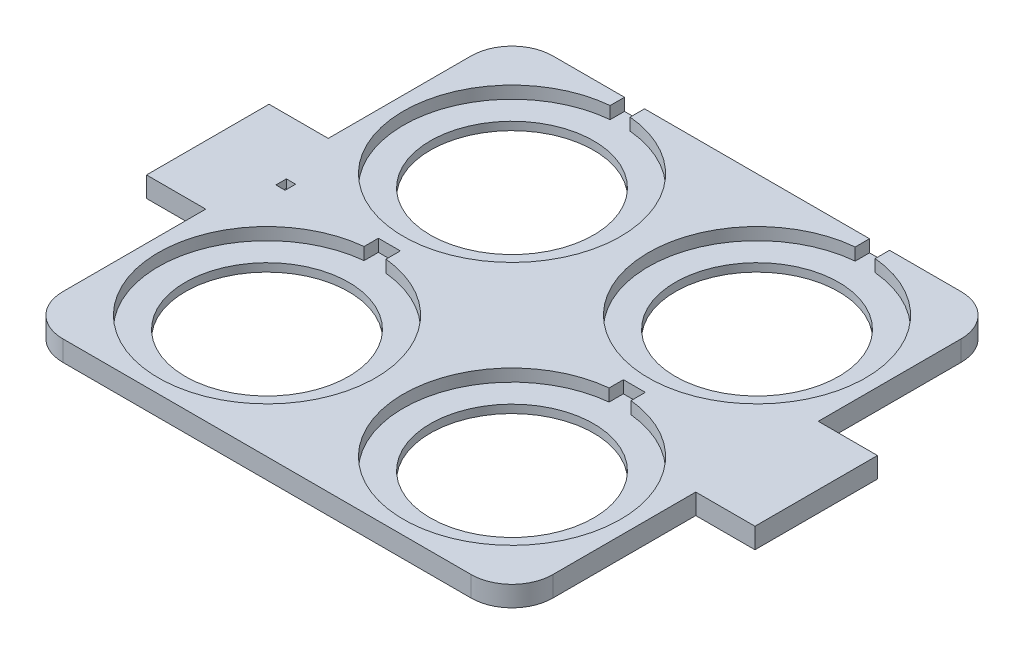
from build123d import *

# Parameters (mm, degrees)
SKETCH1_W           = 120
SKETCH1_H           = 120
BOSS_EXTRUDE1_DEPTH = 5
SKETCH2_R           = 20
CUT_EXTRUDE4_DEPTH  = 5
SKETCH3_R           = 26.6
SKETCH3_R_2         = 20
CUT_EXTRUDE5_DEPTH  = 3
SKETCH4_W           = 60
SKETCH4_H           = 5
BOSS_EXTRUDE2_DEPTH = 14.5
SKETCH5_W           = 60
SKETCH5_H           = 5
BOSS_EXTRUDE3_DEPTH = 14.5
FILLET3_R           = 10
FILLET4_R           = 10
FILLET5_R           = 10
FILLET6_R           = 10
SKETCH10_W          = 2.261137553
SKETCH10_H          = 2.574285836
CUT_EXTRUDE7_DEPTH  = 2
SKETCH12_W          = 5.377639696
SKETCH12_H          = 6.736845814
CUT_EXTRUDE10_DEPTH = 3
SKETCH14_W          = 4.90266265
SKETCH14_H          = 7.042630192
CUT_EXTRUDE11_DEPTH = 3
SKETCH15_W          = 14.5
SKETCH15_H          = 15
CUT_EXTRUDE12_DEPTH = 10


with BuildPart() as part:
    # Sketch1 → Boss-Extrude1 (new body)
    with BuildSketch(Plane(origin=(0, 0, 0), x_dir=(1, 0, 0), z_dir=(0, 1, 0))):
        Rectangle(SKETCH1_W, SKETCH1_H)
    extrude(amount=BOSS_EXTRUDE1_DEPTH)

    # Sketch2 → Cut-Extrude4 (cut)
    with BuildSketch(Plane(origin=(0, 5, 0), x_dir=(1, 0, 0), z_dir=(0, 1, 0))):
        with Locations(Location((30, 30, 0), (0, 0, 270))):
            Circle(SKETCH2_R)
        with Locations(Location((-30, -30, 0), (0, 0, 270))):
            Circle(SKETCH2_R)
        with Locations(Location((30, -30, 0), (0, 0, 270))):
            Circle(SKETCH2_R)
        with Locations(Location((-30, 30, 0), (0, 0, 270))):
            Circle(SKETCH2_R)
    extrude(amount=-CUT_EXTRUDE4_DEPTH, mode=Mode.SUBTRACT)

    # Sketch3 → Cut-Extrude5 (cut)
    # profile 1 of 4: a face of its own
    with BuildSketch(Plane(origin=(0, 5, 0), x_dir=(1, 0, 0), z_dir=(0, 1, 0))):
        with Locations(Location((30, 30, 0), (0, 0, 270))):
            Circle(SKETCH3_R)
        with Locations(Location((30, 30, 0), (0, 0, 270))):
            Circle(SKETCH3_R_2, mode=Mode.SUBTRACT)
    # profile 2 of 4: a face of its own
    with BuildSketch(Plane(origin=(0, 5, 0), x_dir=(1, 0, 0), z_dir=(0, 1, 0))):
        with Locations(Location((-30, -30, 0), (0, 0, 270))):
            Circle(SKETCH3_R)
        with Locations(Location((-30, -30, 0), (0, 0, 270))):
            Circle(SKETCH3_R_2, mode=Mode.SUBTRACT)
    # profile 3 of 4: a face of its own
    with BuildSketch(Plane(origin=(0, 5, 0), x_dir=(1, 0, 0), z_dir=(0, 1, 0))):
        with Locations(Location((30, -30, 0), (0, 0, 270))):
            Circle(SKETCH3_R)
        with Locations(Location((30, -30, 0), (0, 0, 270))):
            Circle(SKETCH3_R_2, mode=Mode.SUBTRACT)
    # profile 4 of 4: a face of its own
    with BuildSketch(Plane(origin=(0, 5, 0), x_dir=(1, 0, 0), z_dir=(0, 1, 0))):
        with Locations(Location((-30, 30, 0), (0, 0, 270))):
            Circle(SKETCH3_R)
    extrude(amount=-CUT_EXTRUDE5_DEPTH, mode=Mode.SUBTRACT)

    # Sketch4 → Boss-Extrude2 (add)
    with BuildSketch(Plane(origin=(60, 0, 0), x_dir=(0, 0, -1), z_dir=(1, 0, 0))):
        with Locations((0, 2.5)):
            Rectangle(SKETCH4_W, SKETCH4_H)
    extrude(amount=BOSS_EXTRUDE2_DEPTH)

    # Sketch5 → Boss-Extrude3 (add)
    with BuildSketch(Plane.ZY.offset(60)):
        with Locations((0, 2.5)):
            Rectangle(SKETCH5_W, SKETCH5_H)
    extrude(amount=BOSS_EXTRUDE3_DEPTH)

    # Fillet3
    fillet3_edges = [part.edges().sort_by_distance(p)[0] for p in [
        (-60, 2.5, 60),
    ]]
    fillet(fillet3_edges, radius=FILLET3_R)

    # Fillet4
    fillet4_edges = [part.edges().sort_by_distance(p)[0] for p in [
        (60, 2.5, 60),
    ]]
    fillet(fillet4_edges, radius=FILLET4_R)

    # Fillet5
    fillet5_edges = [part.edges().sort_by_distance(p)[0] for p in [
        (-60, 2.5, -60),
    ]]
    fillet(fillet5_edges, radius=FILLET5_R)

    # Fillet6
    fillet6_edges = [part.edges().sort_by_distance(p)[0] for p in [
        (60, 2.5, -60),
    ]]
    fillet(fillet6_edges, radius=FILLET6_R)

    # Sketch10 → Cut-Extrude7 (cut)
    with BuildSketch(Plane(origin=(0, 5, 0), x_dir=(1, 0, 0), z_dir=(0, 1, 0))):
        with Locations((-55.406362831, 0)):
            Rectangle(SKETCH10_W, SKETCH10_H)
    extrude(amount=-CUT_EXTRUDE7_DEPTH, mode=Mode.SUBTRACT)

    # Sketch12 → Cut-Extrude10 (cut)
    with BuildSketch(Plane(origin=(0, 5, 0), x_dir=(1, 0, 0), z_dir=(0, 1, 0))):
        with Locations((-30, -3.4)):
            Rectangle(SKETCH12_W, SKETCH12_H)
        with Locations((30, -3.4)):
            Rectangle(SKETCH12_W, SKETCH12_H)
    extrude(amount=-CUT_EXTRUDE10_DEPTH, mode=Mode.SUBTRACT)

    # Sketch14 → Cut-Extrude11 (cut)
    with BuildSketch(Plane(origin=(0, 5, 0), x_dir=(1, 0, 0), z_dir=(0, 1, 0))):
        with Locations((-30, 56.6)):
            Rectangle(SKETCH14_W, SKETCH14_H)
        with Locations((30, 56.6)):
            Rectangle(SKETCH14_W, SKETCH14_H)
    extrude(amount=-CUT_EXTRUDE11_DEPTH, mode=Mode.SUBTRACT)

    # Sketch15 → Cut-Extrude12 (cut)
    with BuildSketch(Plane(origin=(0, 5, 0), x_dir=(1, 0, 0), z_dir=(0, 1, 0))):
        with Locations((-67.25, 22.5)):
            Rectangle(SKETCH15_W, SKETCH15_H)
        with Locations((67.25, 22.5)):
            Rectangle(SKETCH15_W, SKETCH15_H)
        with Locations((67.25, -22.5)):
            Rectangle(SKETCH15_W, SKETCH15_H)
        with Locations((-67.25, -22.5)):
            Rectangle(SKETCH15_W, SKETCH15_H)
    extrude(amount=-CUT_EXTRUDE12_DEPTH, mode=Mode.SUBTRACT)


solid = part.part
